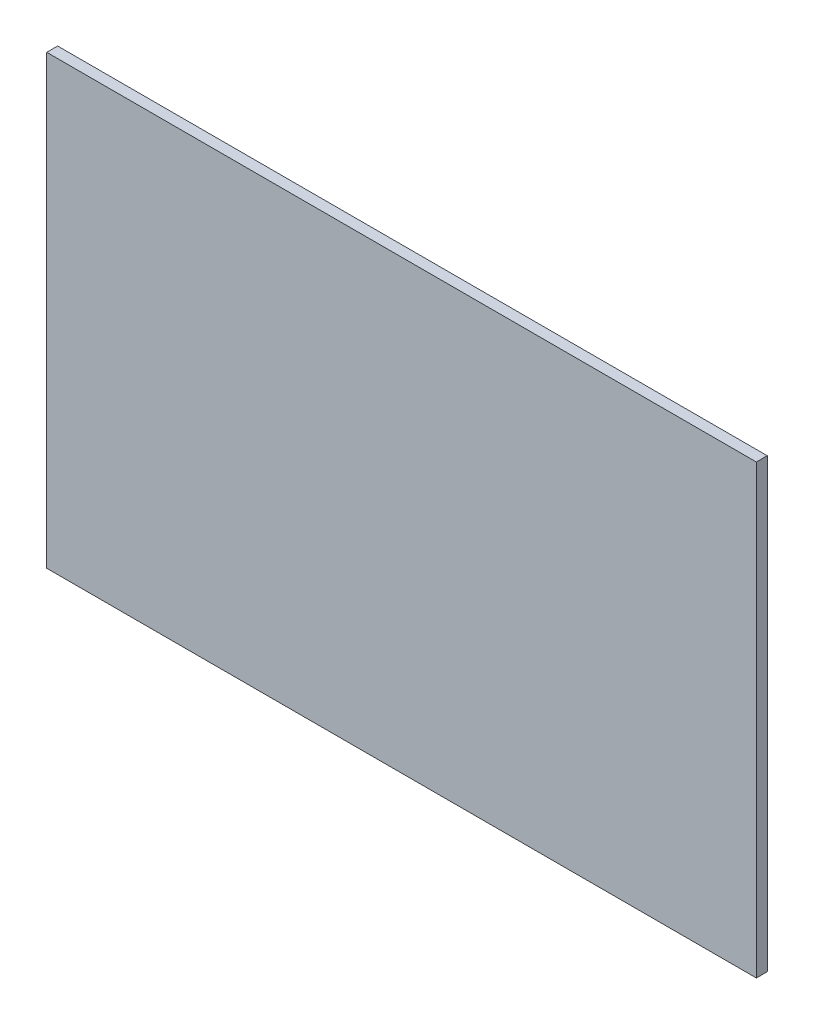
from build123d import *

# Parameters (mm, degrees)
SKETCH1_W           = 228
SKETCH1_H           = 143.572277228
BOSS_EXTRUDE1_DEPTH = 3.5


with BuildPart() as part:
    # Sketch1 → Boss-Extrude1 (new body)
    with BuildSketch(Plane.XY):
        with Locations((-114, 71.786138614)):
            Rectangle(SKETCH1_W, SKETCH1_H)
    extrude(amount=BOSS_EXTRUDE1_DEPTH)


solid = part.part
